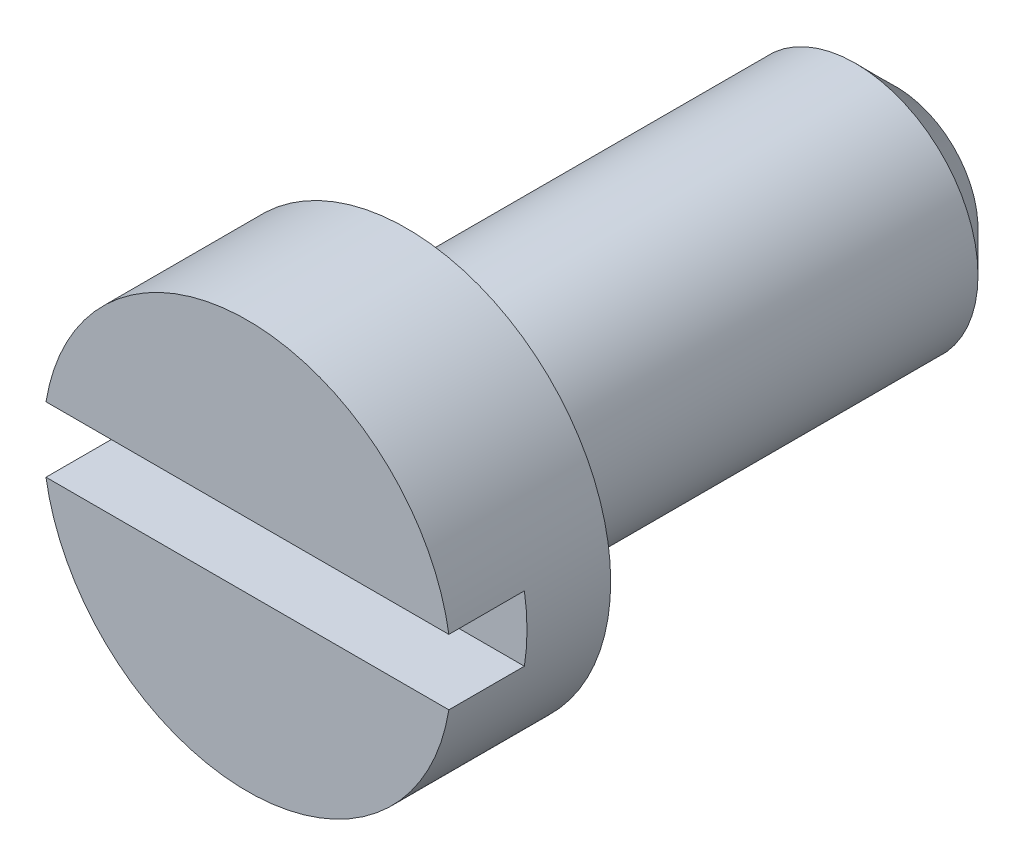
from build123d import *

# Parameters (mm, degrees)
SKETCH_12_R         = 5
EXTRUDE_3_DEPTH     = 3.9
SKETCH_13_R         = 3
EXTRUDE_4_DEPTH     = 12
SKETCH_20_W         = 10.681605976
SKETCH_20_H         = 1.6
CUT_EXTRUDE_8_DEPTH = 1.85
CHAMFER_1_SIZE      = 1


with BuildPart() as part:
    # Эскиз12 → Вытянуть3 (new body)
    with BuildSketch(Plane.XY):
        Circle(SKETCH_12_R)
    extrude(amount=EXTRUDE_3_DEPTH)

    # Эскиз13 → Вытянуть4 (add)
    with BuildSketch(Plane(origin=(0, 0, 0), x_dir=(-1, 0, 0), z_dir=(0, 0, -1))):
        with Locations(Location((0, 0, 0), (0, 0, 180))):
            Circle(SKETCH_13_R)
    extrude(amount=EXTRUDE_4_DEPTH)

    # Эскиз20 → Вырез-Вытянуть8 (cut)
    with BuildSketch(Plane.XY.offset(3.9)):
        with Locations((0.068471833, 0)):
            Rectangle(SKETCH_20_W, SKETCH_20_H)
    extrude(amount=-CUT_EXTRUDE_8_DEPTH, mode=Mode.SUBTRACT)

    # Фаска1
    chamfer_1_edges = [part.edges().sort_by_distance(p)[0] for p in [
        (-3, 0, -12),
    ]]
    chamfer(chamfer_1_edges, length=CHAMFER_1_SIZE)


solid = part.part
